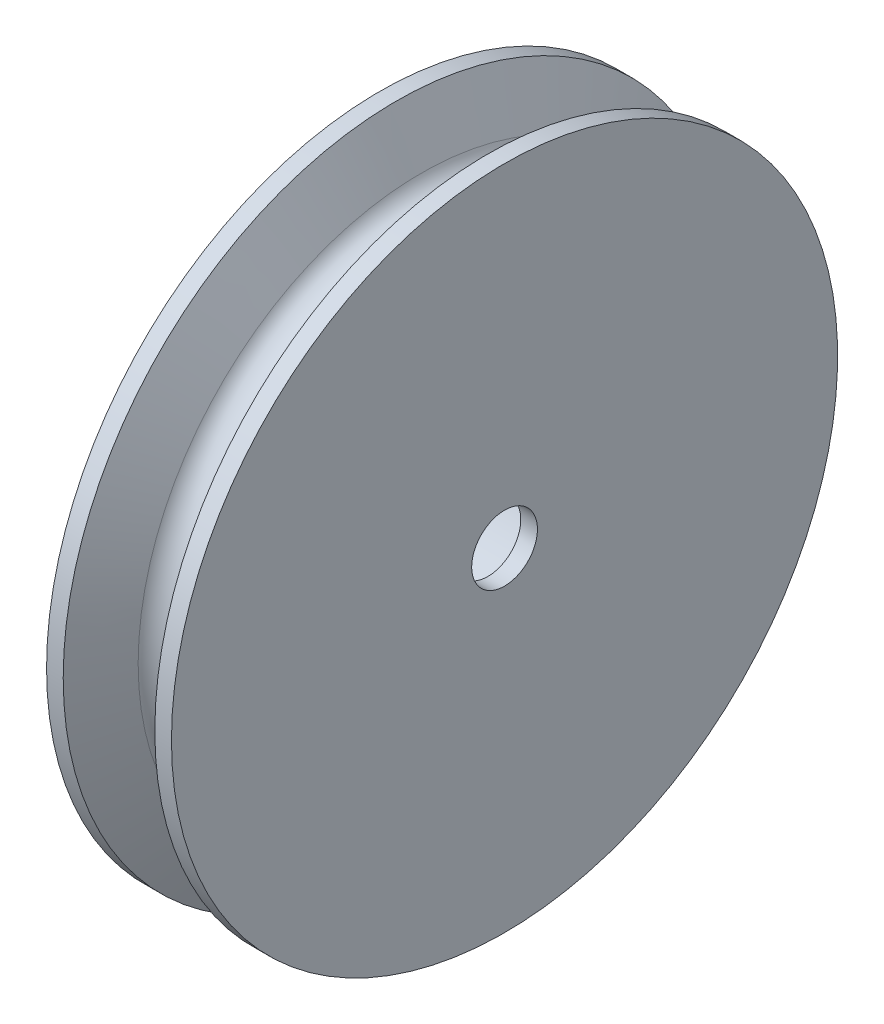
from build123d import *

# Parameters (mm, degrees)
CROQUIS2_R            = 3.95
CORTAR_EXTRUIR1_DEPTH = 62
CROQUIS3_R            = 10.95
CORTAR_EXTRUIR2_DEPTH = 13


with BuildPart() as part:
    # Croquis1 → Revolución1 (revolve)
    with BuildSketch(Plane.XY, mode=Mode.PRIVATE) as revoluci_n1_sk:
        with BuildLine():
            Line((5.952239129, 19.74561549), (2.952239129, 13.74561549))
            ThreePointArc((2.952239129, 13.74561549), (0.452239129, 12.151246549), (-2.047760871, 13.74561549))
            Line((-2.047760871, 13.74561549), (-5.047760871, 19.74561549))
            Line((-5.047760871, 19.74561549), (-7.047760871, 19.74561549))
            Line((-7.047760871, 19.74561549), (-7.047760871, -20.25438451))
            Line((-7.047760871, -20.25438451), (7.952239129, -20.25438451))
            Line((7.952239129, -20.25438451), (7.952239129, 19.74561549))
            Line((7.952239129, 19.74561549), (5.952239129, 19.74561549))
        make_face()
    revolve(revoluci_n1_sk.sketch.rotate(Axis((-20.844407183, -20.25438451, 0), (1, 0, 0)), 90), axis=Axis((-20.844407183, -20.25438451, 0), (1, 0, 0)))

    # Croquis2 → Cortar-Extruir1 (cut)
    with BuildSketch(Plane.ZY.offset(7.047760871)):
        with Locations((0, -20.25438451)):
            Circle(CROQUIS2_R)
    extrude(amount=-CORTAR_EXTRUIR1_DEPTH, mode=Mode.SUBTRACT)

    # Croquis3 → Cortar-Extruir2 (cut)
    with BuildSketch(Plane.ZY.offset(7.047760871)):
        with Locations((0, -20.25438451)):
            Circle(CROQUIS3_R)
    extrude(amount=-CORTAR_EXTRUIR2_DEPTH, mode=Mode.SUBTRACT)


solid = part.part
